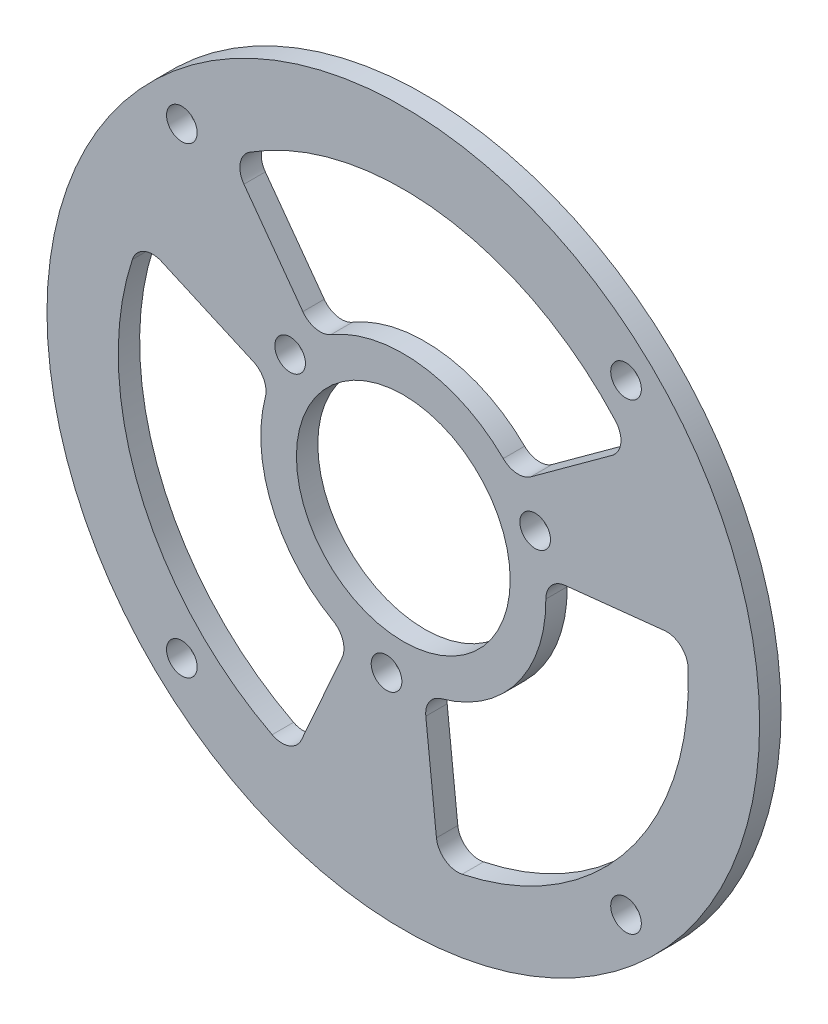
from build123d import *

# Parameters (mm, degrees)
SKETCH_1_R          = 50
SKETCH_1_R_2        = 15
SKETCH_1_R_3        = 2.15
EXTRUDE_1_DEPTH     = 3
SKETCH_2_R          = 2.15
CUT_EXTRUDE_1_DEPTH = 3
CUT_EXTRUDE_2_DEPTH = 3


with BuildPart() as part:
    # 草图1 → 凸台-拉伸1 (new body)
    with BuildSketch(Plane.XY):
        with Locations((-43.046732458, 46.816740082)):
            Circle(SKETCH_1_R)
        with Locations((-43.046732458, 46.816740082)):
            Circle(SKETCH_1_R_2, mode=Mode.SUBTRACT)
        with Locations((-58.927913307, 58.761439339)):
            Circle(SKETCH_1_R_3, mode=Mode.SUBTRACT)
        with Locations((-45.401306439, 26.870517329)):
            Circle(SKETCH_1_R_3, mode=Mode.SUBTRACT)
        with Locations((-24.546261263, 54.530363509)):
            Circle(SKETCH_1_R_3, mode=Mode.SUBTRACT)
    extrude(amount=EXTRUDE_1_DEPTH)

    # 草图2 → 切除-拉伸1 (cut)
    with BuildSketch(Plane(origin=(0, 0, 0), x_dir=(-1, 0, 0), z_dir=(0, 0, -1))):
        with Locations((11.795724887, 79.184319745)):
            Circle(SKETCH_2_R)
        with Locations((74.121262453, 79.184319745)):
            Circle(SKETCH_2_R)
        with Locations((74.121262453, 14.25722704)):
            Circle(SKETCH_2_R)
        with Locations((11.795724887, 14.25722704)):
            Circle(SKETCH_2_R)
    extrude(amount=-CUT_EXTRUDE_1_DEPTH, mode=Mode.SUBTRACT)

    # 草图3 → 切除-拉伸2 (cut)
    with BuildSketch(Plane(origin=(0, 0, 0), x_dir=(-1, 0, 0), z_dir=(0, 0, -1))):
        with BuildLine():
            Line((25.153451443, 60.790750239), (13.742198917, 69.103210849))
            ThreePointArc((13.742198917, 69.103210849), (12.525075816, 71.213815689), (13.27574755, 73.531688287))
            ThreePointArc((13.27574755, 73.531688287), (37.655506434, 86.451758462), (64.600480937, 80.512970235))
            ThreePointArc((64.600480937, 80.512970235), (65.932157971, 78.540792241), (65.408806124, 76.219380472))
            Line((65.408806124, 76.219380472), (57.141381217, 64.869952453))
            ThreePointArc((57.141381217, 64.869952453), (55.325889869, 63.698864431), (53.194378054, 64.05116171))
            ThreePointArc((53.194378054, 64.05116171), (40.603919689, 66.666996145), (29.023333751, 61.076623977))
            ThreePointArc((29.023333751, 61.076623977), (27.140836024, 60.223758694), (25.153451443, 60.790750239))
        make_face()
        with BuildLine():
            Line((20.364867546, 49.996457779), (6.402262109, 51.481543763))
            ThreePointArc((6.402262109, 51.481543763), (4.130184621, 50.774073872), (3.088066895, 48.634718735))
            ThreePointArc((3.088066895, 48.634718735), (11.417412674, 22.330292198), (34.796401106, 7.676836753))
            ThreePointArc((34.796401106, 7.676836753), (37.179073525, 8.185672261), (38.398349384, 10.295034206))
            Line((38.398349384, 10.295034206), (39.891525177, 24.333699088))
            ThreePointArc((39.891525177, 24.333699088), (39.388861968, 26.338320394), (37.709010103, 27.542178607))
            ThreePointArc((37.709010103, 27.542178607), (27.07731282, 34.776074136), (23.047462711, 46.987648143))
            ThreePointArc((23.047462711, 46.987648143), (22.286805197, 49.009740163), (20.364867546, 49.996457779))
        make_face()
        with BuildLine():
            Line((64.095220754, 55.325770919), (76.999649074, 61.051975191))
            ThreePointArc((76.999649074, 61.051975191), (79.436048033, 61.050732296), (81.068048719, 59.241695206))
            ThreePointArc((81.068048719, 59.241695206), (80.067278266, 31.668169586), (61.451649543, 11.302531276))
            ThreePointArc((61.451649543, 11.302531276), (59.077854783, 11.135354132), (57.329129141, 12.749296011))
            Line((57.329129141, 12.749296011), (51.633948612, 25.583810014))
            ThreePointArc((51.633948612, 25.583810014), (51.527502308, 27.741615653), (52.898356609, 29.411410393))
            ThreePointArc((52.898356609, 29.411410393), (61.458964865, 39.007149965), (62.40785352, 51.831417662))
            ThreePointArc((62.40785352, 51.831417662), (62.610499382, 53.888141158), (64.095220754, 55.325770919))
        make_face()
    extrude(amount=-CUT_EXTRUDE_2_DEPTH, mode=Mode.SUBTRACT)


solid = part.part
